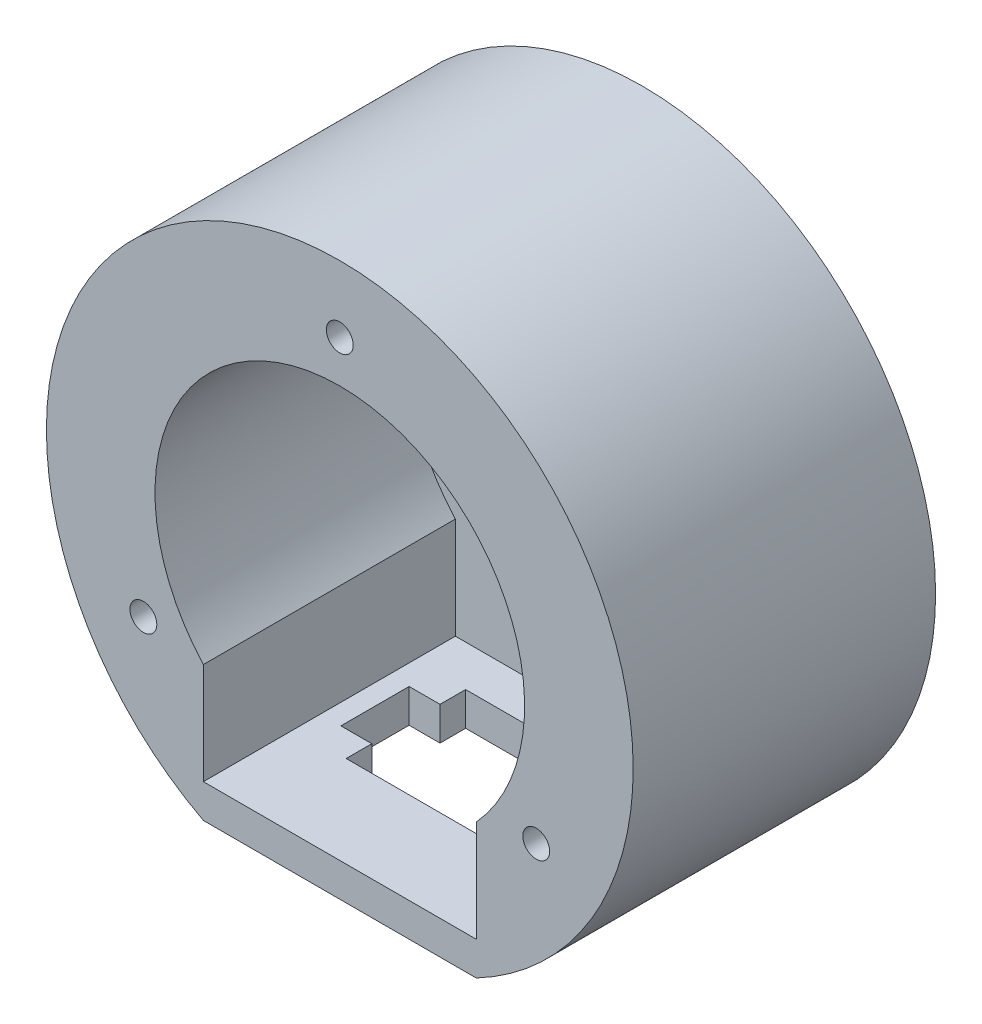
from build123d import *

# Parameters (mm, degrees)
SKETCH2_R           = 17.4625
BOSS_EXTRUDE1_DEPTH = 18
SKETCH13_R          = 0.8
CUT_EXTRUDE6_DEPTH  = 10
SKETCH16_R          = 11
CUT_EXTRUDE9_DEPTH  = 15
CUT_EXTRUDE11_DEPTH = 22
SKETCH21_W          = 16.25
SKETCH21_H          = 2.78436417
CUT_EXTRUDE12_DEPTH = 31.559414466
CUT_EXTRUDE13_REACH = 32.559
SKETCH24_W          = 16.25
SKETCH24_H          = 6.70136321


with BuildPart() as part:
    # Sketch2 → Boss-Extrude1 (new body)
    with BuildSketch(Plane.XY):
        Circle(SKETCH2_R)
    extrude(amount=BOSS_EXTRUDE1_DEPTH)

    # Sketch13 → Cut-Extrude6 (cut)
    with BuildSketch(Plane.XY.offset(18)):
        with Locations((0, 13.5)):
            Circle(SKETCH13_R)
        with Locations((11.691342951, -6.75)):
            Circle(SKETCH13_R)
        with Locations((-11.691342951, -6.75)):
            Circle(SKETCH13_R)
    extrude(amount=-CUT_EXTRUDE6_DEPTH, mode=Mode.SUBTRACT)

    # Sketch16 → Cut-Extrude9 (cut)
    with BuildSketch(Plane.XY.offset(18)):
        Circle(SKETCH16_R)
    extrude(amount=-CUT_EXTRUDE9_DEPTH, mode=Mode.SUBTRACT)

    # Sketch20 → Cut-Extrude11 (cut)
    with BuildSketch(Plane(origin=(5.95728493, 0, -11.08430825), x_dir=(0, 0, 1), z_dir=(0, 1, 0))):
        Polygon((16.52930825, -11.021800725), (16.52930825, -6.906800725), (14.92930825, -6.906800725), (14.92930825, -4.926800725), (16.52930825, -4.926800725), (16.52930825, -0.811800725), (18.05430825, -0.811800725), (18.05430825, 1.028199275), (22.11430825, 1.028199275), (22.11430825, -0.811800725), (23.63930825, -0.811800725), (23.63930825, -11.021800725), (22.11430825, -11.021800725), (22.11430825, -12.861800725), (18.05430825, -12.861800725), (18.05430825, -11.021800725), align=None)
    extrude(amount=-CUT_EXTRUDE11_DEPTH, mode=Mode.SUBTRACT)

    # Sketch21 → Cut-Extrude12 (cut, through all)
    with BuildSketch(Plane.XY.offset(18)):
        with Locations((0, -16.852182085)):
            Rectangle(SKETCH21_W, SKETCH21_H)
    extrude(amount=-CUT_EXTRUDE12_DEPTH, mode=Mode.SUBTRACT)

    # Cut-Extrude13: up to this face of the body (flat: up to its plane)
    cut_extrude13_end = Plane(part.part.faces().sort_by_distance((0, 0, 3))[0])
    # Sketch24 → Cut-Extrude13 (cut, up to the picked face)
    with BuildSketch(Plane.XY.offset(18), mode=Mode.PRIVATE) as cut_extrude13_sk1:
        with Locations((0.005436819, -10.109318395)):
            Rectangle(SKETCH24_W, SKETCH24_H)
    cut_extrude13_tool1 = split(extrude(cut_extrude13_sk1.sketch, amount=-CUT_EXTRUDE13_REACH, mode=Mode.PRIVATE), bisect_by=cut_extrude13_end, keep=Keep.BOTH, mode=Mode.PRIVATE)
    add(cut_extrude13_tool1.solids().sort_by(Axis((0.005437, -10.109318, 18), (0, 0, -1)))[0], mode=Mode.SUBTRACT)


solid = part.part
